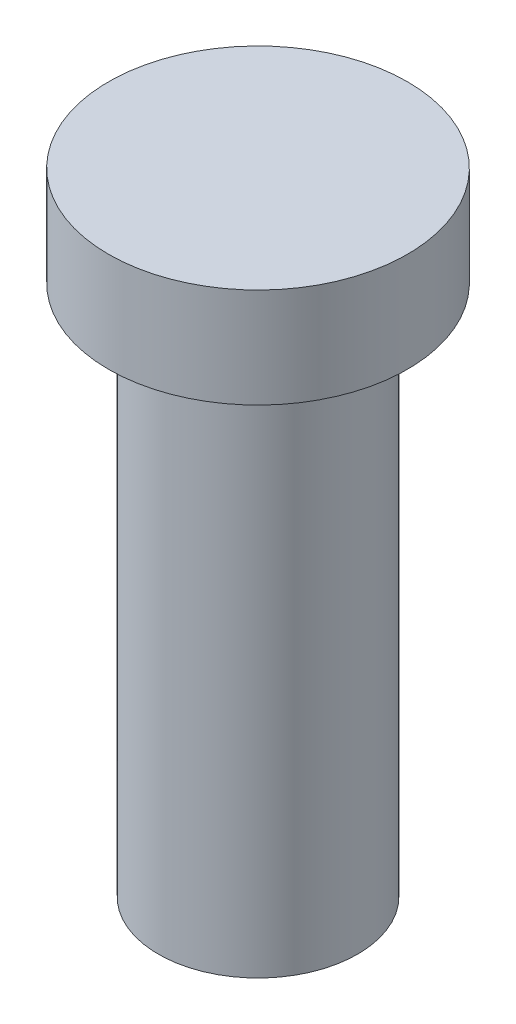
from build123d import *

# Parameters (mm, degrees)
SKETCH_1_R      = 2.25
EXTRUDE_1_DEPTH = 1.5
SKETCH_2_R      = 1.5
EXTRUDE_2_DEPTH = 8


with BuildPart() as part:
    # 草图1 → 凸台-拉伸1 (new body)
    with BuildSketch(Plane(origin=(0, 0, 0), x_dir=(1, 0, 0), z_dir=(0, 1, 0))):
        with Locations(Location((0, 0, 0), (0, 0, 270))):
            Circle(SKETCH_1_R)
    extrude(amount=EXTRUDE_1_DEPTH)

    # 草图2 → 凸台-拉伸2 (add)
    with BuildSketch(Plane.XZ):
        with Locations(Location((0, 0, 0), (0, 0, 270))):
            Circle(SKETCH_2_R)
    extrude(amount=EXTRUDE_2_DEPTH)


solid = part.part
